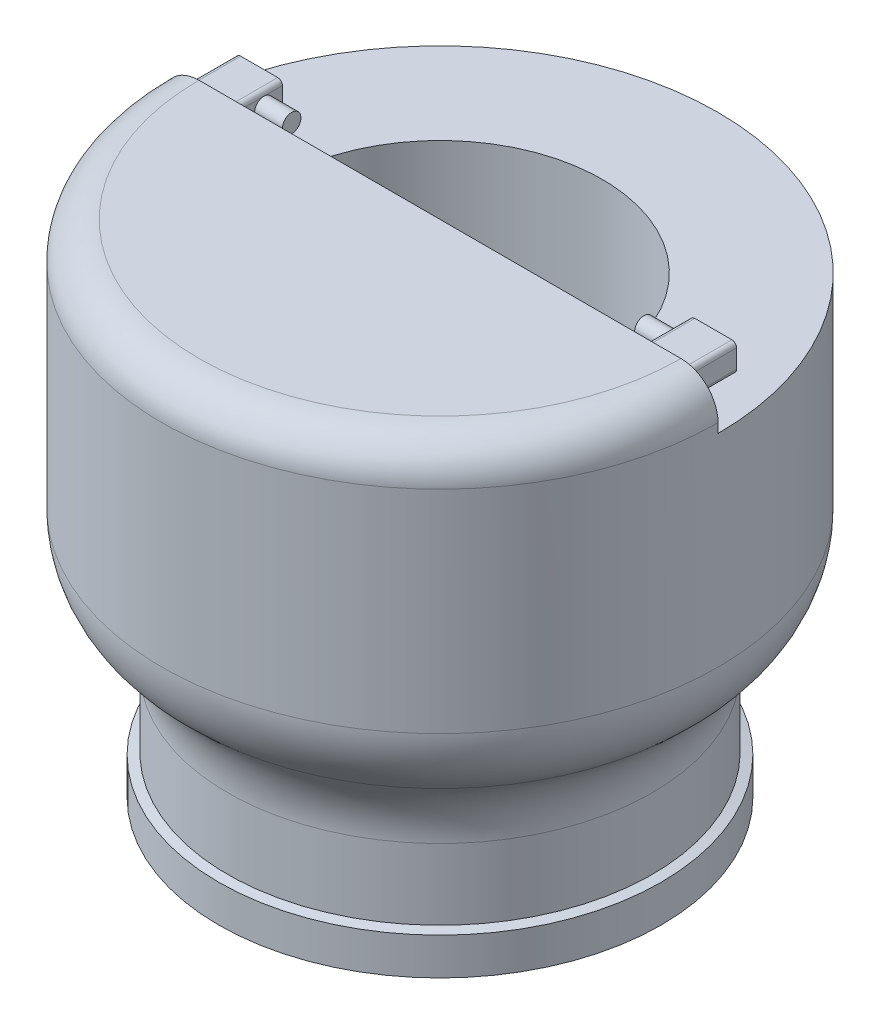
from build123d import *

# Parameters (mm, degrees)
SKETCH10_R              = 10
BOSS_EXTRUDE1_DEPTH     = 5
CUT_EXTRUDE3_DEPTH      = 45
CUT_EXTRUDE3_DEPTH_BACK = 20
CUT_EXTRUDE5_DEPTH      = 5
BOSS_EXTRUDE2_DEPTH     = 5
SKETCH14_R              = 1
BOSS_EXTRUDE3_DEPTH     = 3
BOSS_EXTRUDE4_START     = 3
SKETCH15_R              = 1
BOSS_EXTRUDE4_DEPTH     = 3
CUT_EXTRUDE6_DEPTH      = 10
CUT_EXTRUDE6_DRAFT      = -10
SKETCH18_W              = 50.237541655
SKETCH18_H              = 20.454146011
CUT_EXTRUDE7_DEPTH      = 7
CUT_EXTRUDE7_DRAFT      = -30


with BuildPart() as part:
    # Sketch1 → Revolve1 (revolve)
    with BuildSketch(Plane.XY, mode=Mode.PRIVATE) as revolve1_sk:
        with BuildLine():
            Line((20.9, 0), (23.871591838, 0))
            Line((23.871591838, 0), (23.871591838, 4))
            Line((23.871591838, 4), (22.9, 4.236662843))
            Line((22.9, 4.236662843), (22.9, 11.874576818))
            ThreePointArc((22.9, 11.874576818), (23.83692213, 16.100759435), (26.472123903, 19.535021249))
            Line((26.472123903, 19.535021249), (26.427876097, 19.497892931))
            ThreePointArc((26.427876097, 19.497892931), (29.06307787, 22.932154745), (30, 27.158337362))
            Line((30, 27.158337362), (30, 50))
            ThreePointArc((30, 50), (28.828427125, 52.828427125), (26, 54))
            Line((26, 54), (0, 54))
            Line((0, 54), (0, 15))
            Line((0, 15), (19.9, 15))
            ThreePointArc((19.9, 15), (20.607106781, 14.707106781), (20.9, 14))
            Line((20.9, 14), (20.9, 0))
        make_face()
    revolve(revolve1_sk.sketch.rotate(Axis((0, 0, 0), (0, 1, 0)), 90), axis=Axis((0, 0, 0), (0, 1, 0)))

    # Sketch10 → Boss-Extrude1 (add)
    with BuildSketch(Plane(origin=(0, 0, -30), x_dir=(-1, 0, 0), z_dir=(0, 0, -1))):
        with Locations((3.346345887, 38.658337362)):
            Circle(SKETCH10_R)
    extrude(amount=-BOSS_EXTRUDE1_DEPTH)

    # Sketch11 → Cut-Extrude3 (cut, two sides: drawn at the far end of the back side and taken through both)
    with BuildSketch(Plane(origin=(0, 17, 0), x_dir=(1, 0, 0), z_dir=(0, 1, 0)).offset(-CUT_EXTRUDE3_DEPTH_BACK)):
        with BuildLine():
            Line((-17.5, 0), (17.5, 0))
            ThreePointArc((17.5, 0), (0, 17.5), (-17.5, 0))
        make_face()
    extrude(amount=CUT_EXTRUDE3_DEPTH + CUT_EXTRUDE3_DEPTH_BACK, mode=Mode.SUBTRACT)

    # Sketch9 → Cut-Extrude5 (cut)
    with BuildSketch(Plane(origin=(0, 54, 0), x_dir=(1, 0, 0), z_dir=(0, 1, 0))):
        with BuildLine():
            Line((-30, 0), (30, 0))
            ThreePointArc((30, 0), (0, 30), (-30, 0))
        make_face()
    extrude(amount=-CUT_EXTRUDE5_DEPTH, mode=Mode.SUBTRACT)

    # Sketch13 → Boss-Extrude2 (add)
    with BuildSketch(Plane(origin=(0, 0, 0), x_dir=(-1, 0, 0), z_dir=(0, 0, -1))):
        with BuildLine():
            Line((22.5, 53.5), (26.5, 53.5))
            ThreePointArc((26.5, 53.5), (26.853553391, 53.353553391), (27, 53))
            Line((27, 53), (27, 51))
            ThreePointArc((27, 51), (26.853553391, 50.646446609), (26.5, 50.5))
            Line((26.5, 50.5), (22.5, 50.5))
            ThreePointArc((22.5, 50.5), (22.146446609, 50.646446609), (22, 51))
            Line((22, 51), (22, 53))
            ThreePointArc((22, 53), (22.146446609, 53.353553391), (22.5, 53.5))
        make_face()
        with BuildLine():
            Line((-26.5, 53.5), (-22.5, 53.5))
            ThreePointArc((-22.5, 53.5), (-22.146446609, 53.353553391), (-22, 53))
            Line((-22, 53), (-22, 51))
            ThreePointArc((-22, 51), (-22.146446609, 50.646446609), (-22.5, 50.5))
            Line((-22.5, 50.5), (-26.5, 50.5))
            ThreePointArc((-26.5, 50.5), (-26.853553391, 50.646446609), (-27, 51))
            Line((-27, 51), (-27, 53))
            ThreePointArc((-27, 53), (-26.853553391, 53.353553391), (-26.5, 53.5))
        make_face()
    extrude(amount=BOSS_EXTRUDE2_DEPTH)

    # Sketch14 → Boss-Extrude3 (add)
    with BuildSketch(Plane.ZY.offset(-22)):
        with Locations(Location((-3, 52, 0), (0, 0, 270))):
            Circle(SKETCH14_R)
    extrude(amount=BOSS_EXTRUDE3_DEPTH)

    # Sketch15 → Boss-Extrude4 (add)
    with BuildSketch(Plane(origin=(-22, 0, 0), x_dir=(0, 0, -1), z_dir=(1, 0, 0)).offset(BOSS_EXTRUDE4_START)):
        with Locations(Location((3, 52, 0), (0, 0, 270))):
            Circle(SKETCH15_R)
    extrude(amount=-BOSS_EXTRUDE4_DEPTH)


with BuildPart() as cut_extrude6_tool:
    # Sketch17 → Cut-Extrude6 (with draft: the straight prism first)
    with BuildSketch(Plane(origin=(0, 0, 0), x_dir=(-1, 0, 0), z_dir=(0, 0, -1))):
        with BuildLine():
            ThreePointArc((-24.47851765, 47.302362136), (-25.892731213, 46.716575698), (-26.47851765, 45.302362136))
            Line((-26.47851765, 45.302362136), (-26.47851765, 25.01560965))
            ThreePointArc((-26.47851765, 25.01560965), (-25.892731213, 23.601396087), (-24.47851765, 23.01560965))
            Line((-24.47851765, 23.01560965), (25.354900287, 23.01560965))
            ThreePointArc((25.354900287, 23.01560965), (26.769113849, 23.601396087), (27.354900287, 25.01560965))
            Line((27.354900287, 25.01560965), (27.354900287, 45.302362136))
            ThreePointArc((27.354900287, 45.302362136), (26.769113849, 46.716575698), (25.354900287, 47.302362136))
            Line((25.354900287, 47.302362136), (-24.47851765, 47.302362136))
        make_face()
    extrude(amount=-CUT_EXTRUDE6_DEPTH)
    # Cut-Extrude6: the draft: its side faces are tilted about the plane it starts from
    cut_extrude6_sides = [cut_extrude6_tool.faces().sort_by_distance(p)[0] for p in [
        (25.892731213, 46.716575698, 5),
        (26.47851765, 35.158985893, 5),
        (25.892731213, 23.601396087, 5),
        (-0.438191318, 23.01560965, 5),
        (-26.769113849, 23.601396087, 5),
        (-27.354900287, 35.158985893, 5),
        (-26.769113849, 46.716575698, 5),
        (-0.438191318, 47.302362136, 5),
    ]]
    draft(cut_extrude6_sides, Plane(origin=(0, 0, 0), x_dir=(-1, 0, 0), z_dir=(0, 0, -1)), CUT_EXTRUDE6_DRAFT)


with BuildPart() as part_1:
    add(part.part)

    # Cut-Extrude6: cut by cut_extrude6_tool
    add(cut_extrude6_tool.part, mode=Mode.SUBTRACT)


with BuildPart() as cut_extrude7_tool:
    # Sketch18 → Cut-Extrude7 (with draft: the straight prism first)
    with BuildSketch(Plane(origin=(0, 0, 10), x_dir=(-1, 0, 0), z_dir=(0, 0, -1))):
        with Locations((0.403522985, 35.07528913)):
            Rectangle(SKETCH18_W, SKETCH18_H)
    extrude(amount=-CUT_EXTRUDE7_DEPTH)
    # Cut-Extrude7: the draft: its side faces are tilted about the plane it starts from
    cut_extrude7_sides = [cut_extrude7_tool.faces().sort_by_distance(p)[0] for p in [
        (24.715247843, 35.07528913, 13.5),
        (-0.403522984, 24.848216125, 13.5),
        (-25.522293812, 35.07528913, 13.5),
        (-0.403522984, 45.302362136, 13.5),
    ]]
    draft(cut_extrude7_sides, Plane(origin=(0, 0, 10), x_dir=(-1, 0, 0), z_dir=(0, 0, -1)), CUT_EXTRUDE7_DRAFT)


with BuildPart() as part_2:
    add(part_1.part)

    # Cut-Extrude7: cut by cut_extrude7_tool
    add(cut_extrude7_tool.part, mode=Mode.SUBTRACT)


solid = part_2.part
